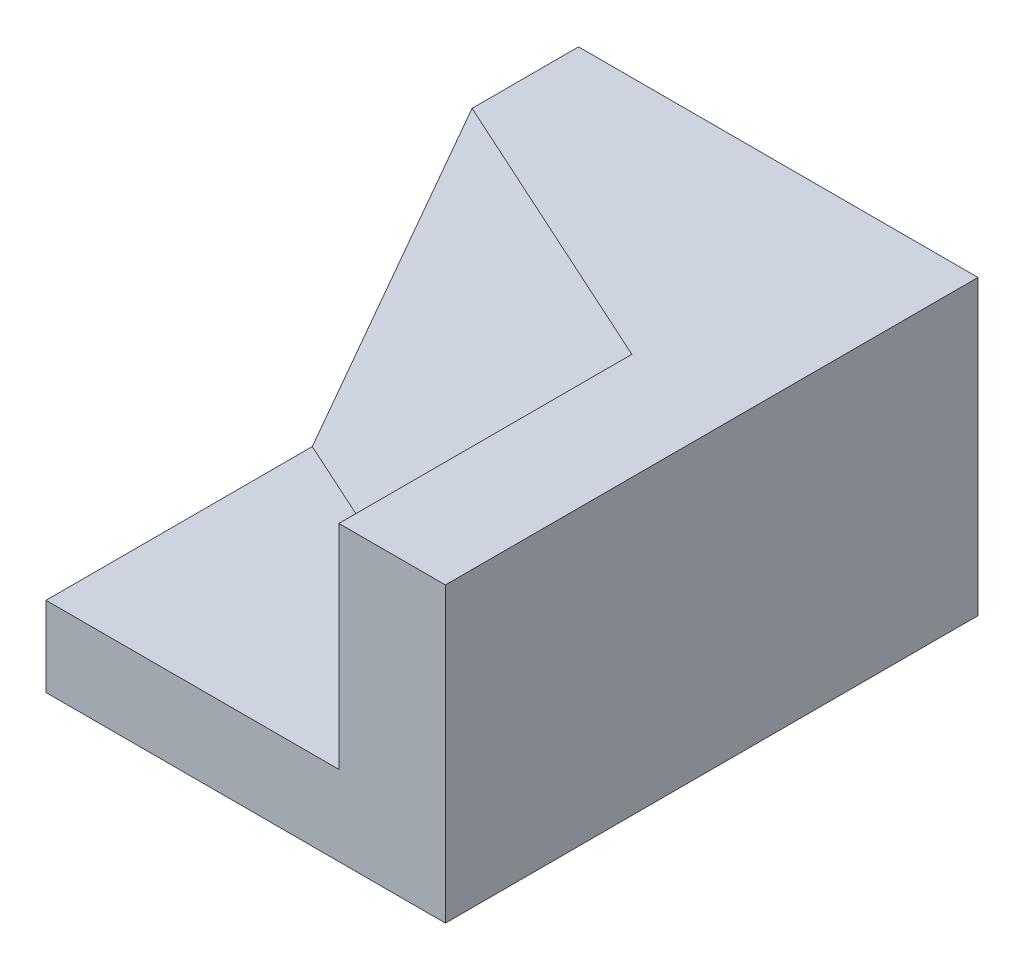
from build123d import *

# Parameters (mm, degrees)
BOSS_EXTRUDE1_DEPTH = 100
BOSS_EXTRUDE2_START = -25
SKETCH3_W           = 55
SKETCH3_H           = 40
BOSS_EXTRUDE2_DEPTH = 75
CUT_EXTRUDE1_DEPTH  = 75


with BuildPart() as part:
    # Sketch2 → Boss-Extrude1 (new body)
    with BuildSketch(Plane.XY):
        Polygon((0, 0), (-75, 0), (-75, 15), (-20, 15), (-20, 55), (0, 55), align=None)
    extrude(amount=BOSS_EXTRUDE1_DEPTH)

    # Sketch3 → Boss-Extrude2 (add)
    with BuildSketch(Plane.XY.offset(100).offset(BOSS_EXTRUDE2_START)):
        with Locations((-47.5, 35)):
            Rectangle(SKETCH3_W, SKETCH3_H)
    extrude(amount=-BOSS_EXTRUDE2_DEPTH)

    # Sketch6 → Cut-Extrude1 (cut, along a direction that is not the sketch's normal)
    with BuildSketch(Plane(origin=(-24.496350365, 40.418978102, 53.891970803), x_dir=(0.9397934234884371, 0.20504583785202254, 0.27339445046936345), z_dir=(-0.3417430630867043, 0.5638760540930621, 0.7518347387907499))):
        Polygon((4.784402883, 17), (-53.73909667, 32), (-53.73909667, -18), (4.784402883, -33), align=None)
    extrude(amount=CUT_EXTRUDE1_DEPTH, dir=(0, 0, 1), mode=Mode.SUBTRACT)


solid = part.part
